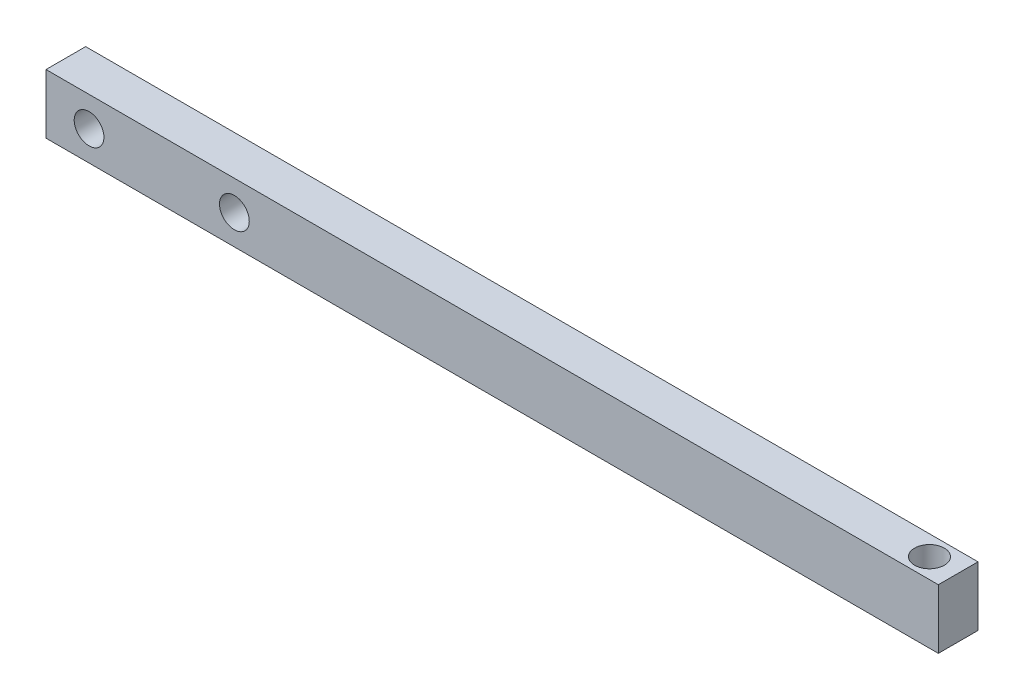
from build123d import *

# Parameters (mm, degrees)
CROQUIS1_W              = 1016
CROQUIS1_H              = 76.2
SALIENTE_EXTRUIR1_DEPTH = 50.8
CROQUIS2_R              = 19.05
CORTAR_EXTRUIR1_DEPTH   = 512.953367017
CROQUIS5_R              = 19.05
CORTAR_EXTRUIR3_DEPTH   = 517.188996396
CROQUIS6_W              = 50.8
CROQUIS6_H              = 76.2
SALIENTE_EXTRUIR2_DEPTH = 127
CROQUIS7_R              = 19.05
CORTAR_EXTRUIR4_DEPTH   = 639.167101941


with BuildPart() as part:
    # Croquis1 → Saliente-Extruir1 (new body)
    with BuildSketch(Plane.XY):
        Rectangle(CROQUIS1_W, CROQUIS1_H)
    extrude(amount=SALIENTE_EXTRUIR1_DEPTH)

    # Croquis2 → Cortar-Extruir1 (cut, through all)
    with BuildSketch(Plane.XY.offset(50.8)):
        with Locations((-393.7, 0)):
            Circle(CROQUIS2_R)
    extrude(amount=-CORTAR_EXTRUIR1_DEPTH, mode=Mode.SUBTRACT)

    # Croquis5 → Cortar-Extruir3 (cut, through all)
    with BuildSketch(Plane(origin=(0, 38.1, 0), x_dir=(1, 0, 0), z_dir=(0, 1, 0))):
        with Locations(Location((471.22697118, -25.4, 0), (0, 0, 180))):
            Circle(CROQUIS5_R)
    extrude(amount=-CORTAR_EXTRUIR3_DEPTH, mode=Mode.SUBTRACT)

    # Croquis6 → Saliente-Extruir2 (add)
    with BuildSketch(Plane.ZY.offset(508)):
        with Locations((25.4, 0)):
            Rectangle(CROQUIS6_W, CROQUIS6_H)
    extrude(amount=SALIENTE_EXTRUIR2_DEPTH)

    # Croquis7 → Cortar-Extruir4 (cut, through all)
    with BuildSketch(Plane.XY.offset(50.8)):
        with Locations((-579.845937481, 0)):
            Circle(CROQUIS7_R)
    extrude(amount=-CORTAR_EXTRUIR4_DEPTH, mode=Mode.SUBTRACT)


solid = part.part
